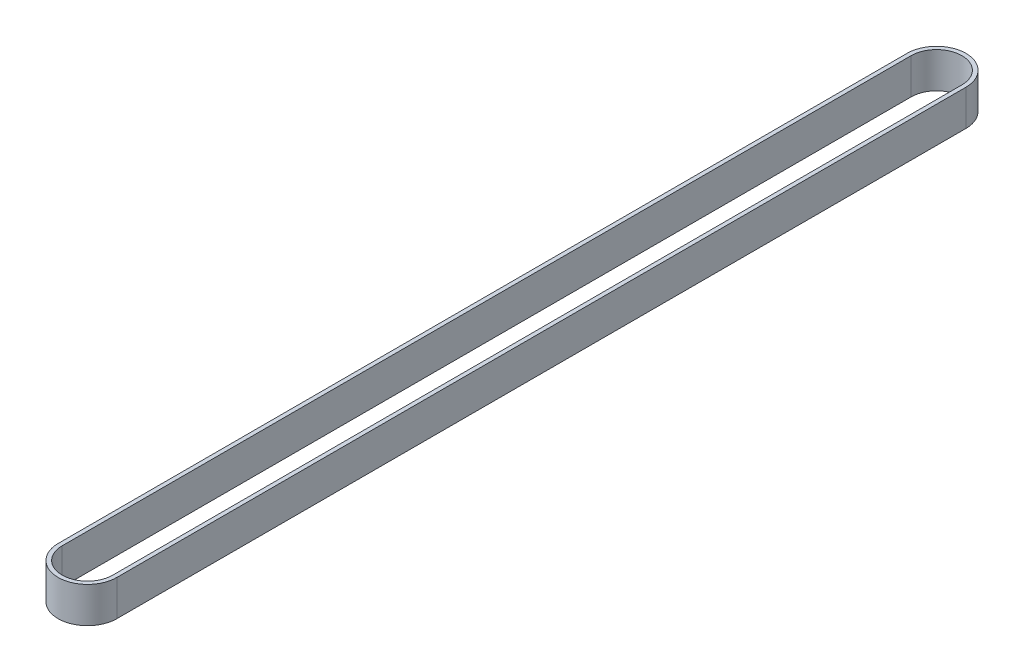
from build123d import *

# Parameters (mm, degrees)
EXTRUDE_1_DEPTH = 8


with BuildPart() as part:
    # 草图1 → 凸台-拉伸1 (new, symmetric)
    with BuildSketch(Plane(origin=(0, 0, 0), x_dir=(1, 0, 0), z_dir=(0, 1, 0))):
        with BuildLine():
            Line((13.15, 190), (13.15, -190))
            ThreePointArc((13.15, -190), (0, -203.15), (-13.15, -190))
            Line((-13.15, -190), (-13.15, 190))
            ThreePointArc((-13.15, 190), (0, 203.15), (13.15, 190))
        make_face()
        with BuildLine():
            Line((11.35, 190), (11.35, -190))
            ThreePointArc((11.35, -190), (0, -201.35), (-11.35, -190))
            Line((-11.35, -190), (-11.35, 190))
            ThreePointArc((-11.35, 190), (0, 201.35), (11.35, 190))
        make_face(mode=Mode.SUBTRACT)
    extrude(amount=EXTRUDE_1_DEPTH, both=True)


solid = part.part
